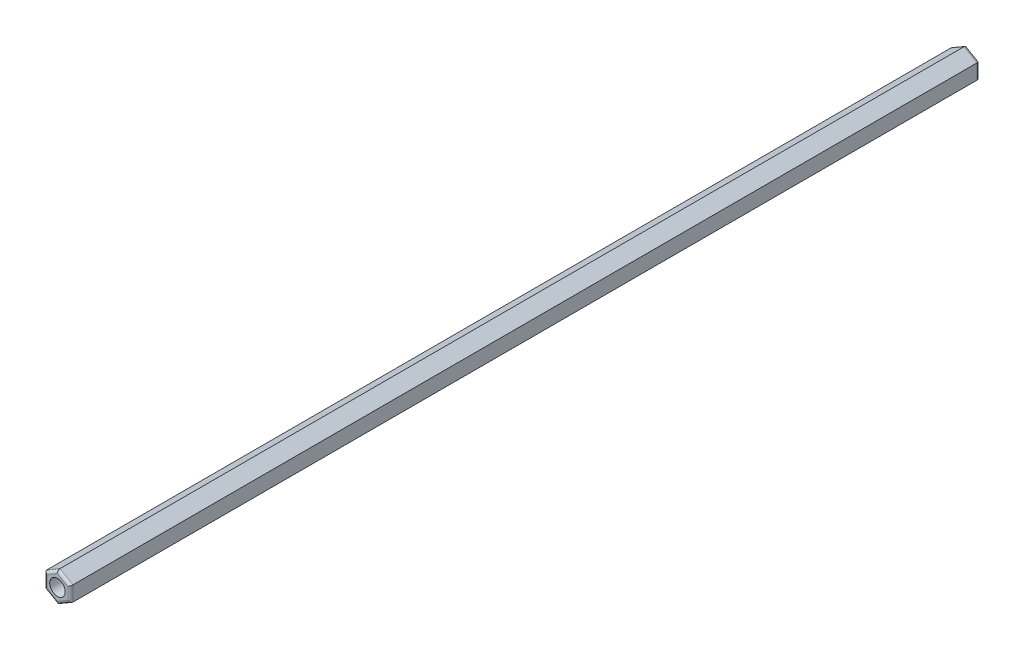
from build123d import *

# Parameters (mm, degrees)
RESSALTO_EXTRUS_O1_DEPTH = 175
FILETE1_R                = 0.5
ESBO_O2_R                = 1.5
CORTE_EXTRUS_O1_DEPTH    = 190.446275038


with BuildPart() as part:
    # Esboço1 → Ressalto-extrusão1 (new body)
    with BuildSketch(Plane(origin=(0, 0, 0), x_dir=(-1, 0, 0), z_dir=(0, 0, -1))):
        Polygon((67.502122675, -1.443375673), (70.002122675, -2.886751346), (72.502122675, -1.443375673), (72.502122675, 1.443375673), (70.002122675, 2.886751346), (67.502122675, 1.443375673), align=None)
    extrude(amount=-RESSALTO_EXTRUS_O1_DEPTH)

    # Filete1
    filete1_edges = [part.edges().sort_by_distance(p)[0] for p in [
        (-71.252122675, -2.165063509, 175),
        (-72.502122675, 0, 175),
        (-71.252122675, 2.165063509, 175),
        (-68.752122675, 2.165063509, 175),
        (-67.502122675, 0, 175),
        (-68.752122675, 2.165063509, 0),
        (-71.252122675, 2.165063509, 0),
        (-72.502122675, 0, 0),
        (-71.252122675, -2.165063509, 0),
        (-68.752122675, -2.165063509, 0),
        (-67.502122675, 0, 0),
        (-68.752122675, -2.165063509, 175),
    ]]
    fillet(filete1_edges, radius=FILETE1_R)

    # Esboço2 → Corte-extrusão1 (cut, through all)
    with BuildSketch(Plane.XY.offset(175)):
        with Locations((-70.002122675, 0)):
            Circle(ESBO_O2_R)
    extrude(amount=-CORTE_EXTRUS_O1_DEPTH, mode=Mode.SUBTRACT)


solid = part.part
